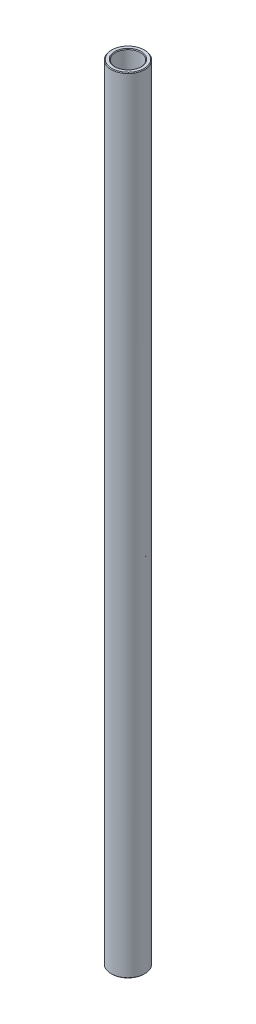
from build123d import *

# Parameters (mm, degrees)
SKETCH1_W     = 1.5875
SKETCH1_H     = 297.18
CHAMFER1_SIZE = 0.254


with BuildPart() as part:
    # Sketch1 → Revolve1 (revolve)
    with BuildSketch(Plane.XY, mode=Mode.PRIVATE) as revolve1_sk:
        with Locations((5.55625, 0)):
            Rectangle(SKETCH1_W, SKETCH1_H)
    revolve(revolve1_sk.sketch.rotate(Axis((0, 11.60859375, 0), (0, -1, 0)), 180), axis=Axis((0, 11.60859375, 0), (0, -1, 0)))

    # Chamfer1
    chamfer1_edges = [part.edges().sort_by_distance(p)[0] for p in [
        (4.7625, -148.59, 0),
        (6.35, -148.59, 0),
        (6.35, 148.59, 0),
        (4.7625, 148.59, 0),
    ]]
    chamfer(chamfer1_edges, length=CHAMFER1_SIZE)


solid = part.part
